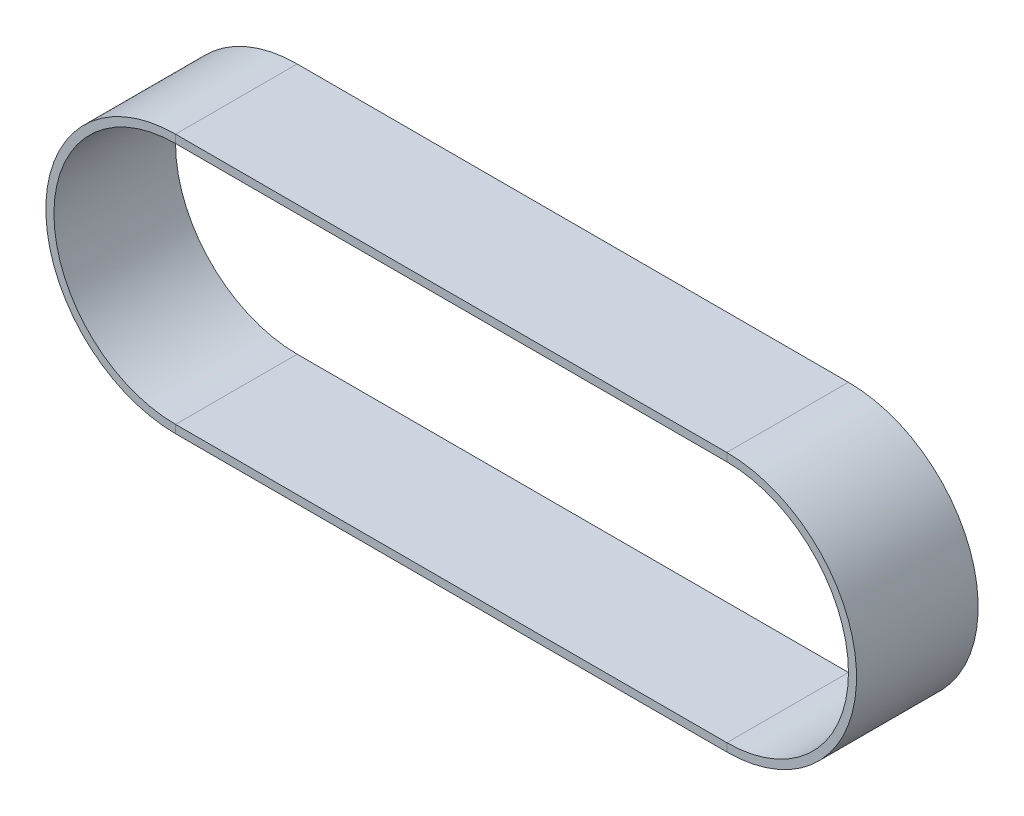
from build123d import *


with BuildPart() as part:
    # Austragung1: sweep along a path in Skizze2
    with BuildLine(Plane.XY) as austragung1_path:
        Line((2, -300), (-1358, -300))
        ThreePointArc((-1358, -300), (-1658, 0), (-1358, 300))
        Line((-1358, 300), (2, 300))
        ThreePointArc((2, 300), (302, 0), (2, -300))
    # 3D-Skizze2 → Austragung1 (sweep)
    with BuildSketch(Plane(origin=(2, 320, -150), x_dir=(0, -0.066519010523774, 0.997785157856609), z_dir=(-1, 0, 0))):
        Polygon((0, 0), (299.335547357, 19.955703157), (300.665927567, 0), (1.33038021, -19.955703157), align=None)
    sweep(path=austragung1_path.line)


solid = part.part
